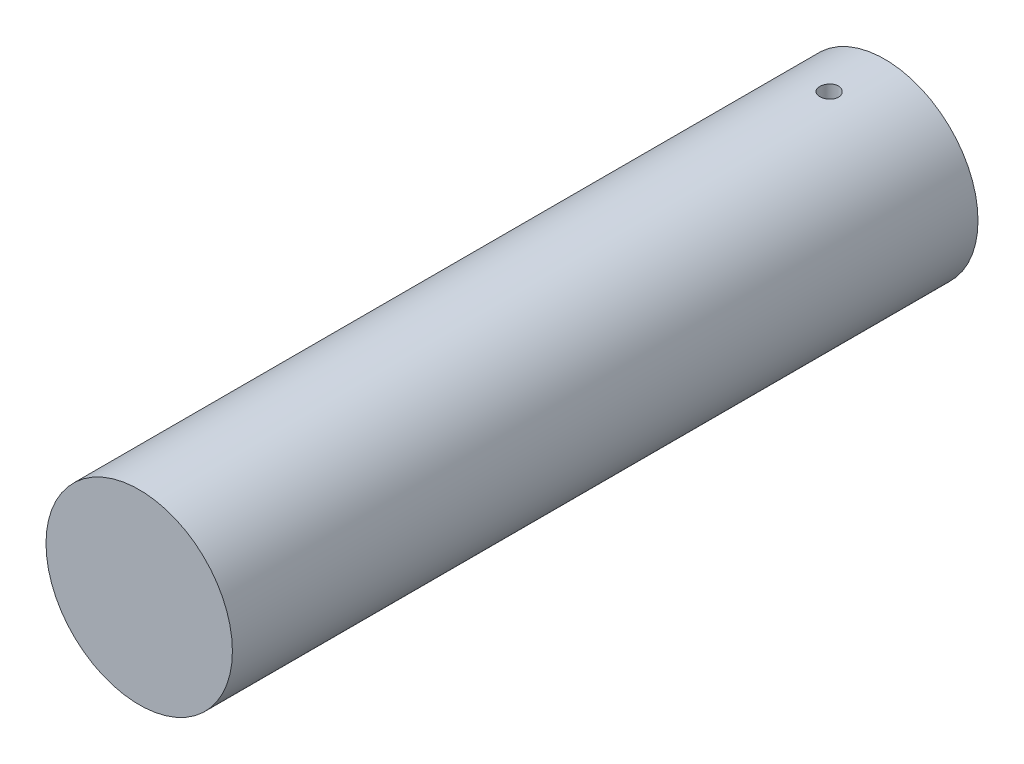
from build123d import *

# Parameters (mm, degrees)
SCHIZZO1_R                    = 50
ESTRUSIONE_ESTRUSIONE1_DEPTH  = 400
TAGLIO_ESTRUSIONE1_DEPTH      = 407.201920232
TAGLIO_ESTRUSIONE1_DEPTH_BACK = 407.201920232
SCHIZZO2_R                    = 5


with BuildPart() as part:
    # Schizzo1 → Estrusione-Estrusione1 (new body)
    with BuildSketch(Plane.XY):
        Circle(SCHIZZO1_R)
    extrude(amount=ESTRUSIONE_ESTRUSIONE1_DEPTH)

    # Schizzo2 → Taglio-Estrusione1 (cut, two sides: drawn at the far end of the back side and taken through both)
    with BuildSketch(Plane(origin=(0, 0, 0), x_dir=(1, 0, 0), z_dir=(0, 1, 0)).offset(-TAGLIO_ESTRUSIONE1_DEPTH_BACK)):
        with Locations(Location((0, -29.895202987, 0), (0, 0, 270))):
            Circle(SCHIZZO2_R)
    extrude(amount=TAGLIO_ESTRUSIONE1_DEPTH + TAGLIO_ESTRUSIONE1_DEPTH_BACK, mode=Mode.SUBTRACT)


solid = part.part
